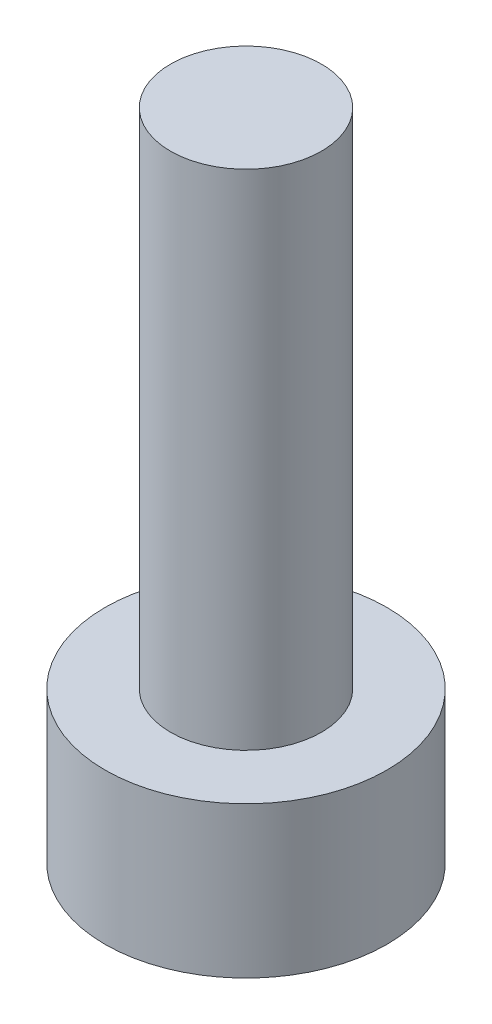
from build123d import *

# Parameters (mm, degrees)
SKETCH_1_R          = 2.8
EXTRUDE_1_DEPTH     = 3
SKETCH_2_R          = 1.5
EXTRUDE_2_DEPTH     = 10
CUT_EXTRUDE_1_DEPTH = 1.5


with BuildPart() as part:
    # 草图1 → 凸台-拉伸1 (new body)
    with BuildSketch(Plane(origin=(0, 0, 0), x_dir=(1, 0, 0), z_dir=(0, 1, 0))):
        with Locations(Location((0, 0, 0), (0, 0, 270))):
            Circle(SKETCH_1_R)
    extrude(amount=EXTRUDE_1_DEPTH)

    # 草图2 → 凸台-拉伸2 (add)
    with BuildSketch(Plane(origin=(0, 3, 0), x_dir=(1, 0, 0), z_dir=(0, 1, 0))):
        with Locations(Location((0, 0, 0), (0, 0, 270))):
            Circle(SKETCH_2_R)
    extrude(amount=EXTRUDE_2_DEPTH)

    # 草图3 → 切除-拉伸1 (cut)
    with BuildSketch(Plane.XZ):
        Polygon((1.084583442, -0.952371824), (1.367069914, 0.463090901), (0.282486472, 1.415462725), (-1.084583442, 0.952371824), (-1.367069914, -0.463090901), (-0.282486472, -1.415462725), align=None)
    extrude(amount=-CUT_EXTRUDE_1_DEPTH, mode=Mode.SUBTRACT)


solid = part.part
